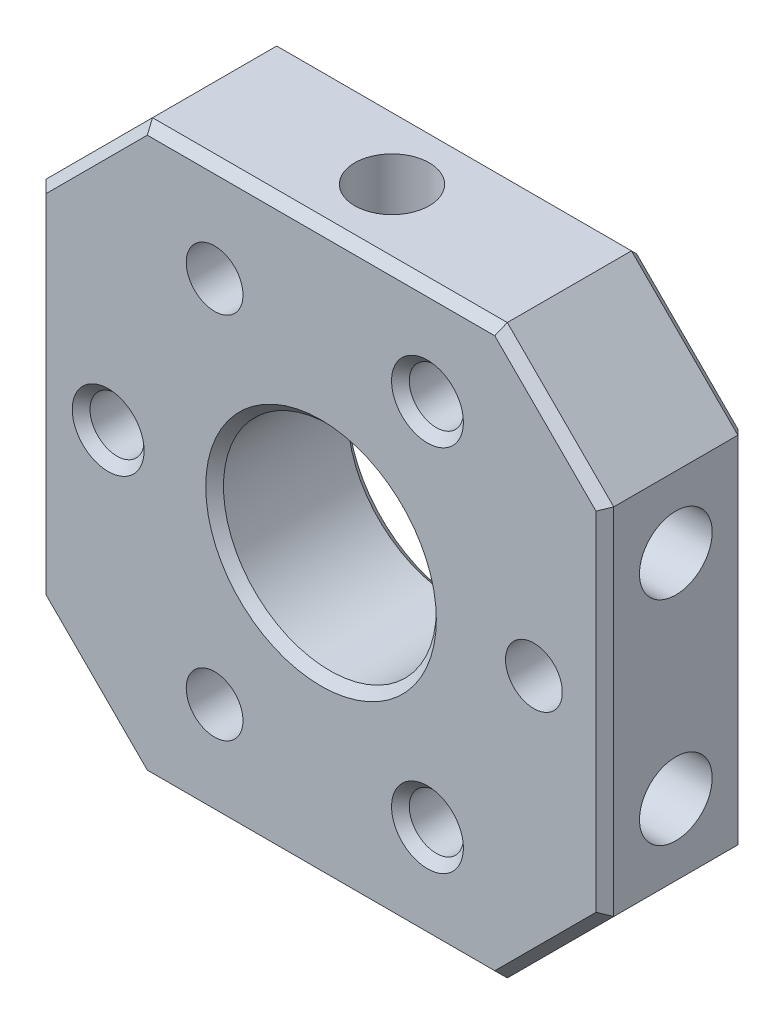
from build123d import *

# Parameters (mm, degrees)
SKETCH_1_W                   = 32
SKETCH_1_H                   = 32
SKETCH_1_R                   = 6
EXTRUDE_1_DEPTH              = 8
SKETCH_2_R                   = 1.525
CUT_EXTRUDE_1_DEPTH          = 4
CHAMFER_1_SIZE               = 6
SKETCH_4_R                   = 2.1
CUT_EXTRUDE_2_DEPTH          = 4.5
SKETCH_5_R                   = 2.05
CUT_EXTRUDE_3_DEPTH          = 4.5
SKETCH_6_R                   = 2.05
CUT_EXTRUDE_4_DEPTH          = 4.5
CUT_EXTRUDE_START            = -4.5
SKETCH_7_R                   = 2.05
CUT_EXTRUDE_5_DEPTH          = 4.5
CHAMFER_2_SIZE               = 0.5
HOLE_WIZARD_M3_1_D           = 3.2
HOLE_WIZARD_M3_1_CBORE_D     = 6
HOLE_WIZARD_M3_1_CBORE_DEPTH = 3.4


with BuildPart() as part:
    # 草图1 → 凸台-拉伸1 (new body)
    with BuildSketch(Plane.XY):
        Rectangle(SKETCH_1_W, SKETCH_1_H)
        Circle(SKETCH_1_R, mode=Mode.SUBTRACT)
    extrude(amount=EXTRUDE_1_DEPTH)

    # 草图2 → 切除-拉伸1 (cut)
    with BuildSketch(Plane.XY.offset(8)):
        with Locations((-12, 0)):
            Circle(SKETCH_2_R)
        with Locations((6, 10.392304845)):
            Circle(SKETCH_2_R)
        with Locations((6, -10.392304845)):
            Circle(SKETCH_2_R)
    extrude(amount=-CUT_EXTRUDE_1_DEPTH, mode=Mode.SUBTRACT)

    # 倒角1
    chamfer_1_edges = [part.edges().sort_by_distance(p)[0] for p in [
        (16, -16, 4),
        (-16, -16, 4),
        (-16, 16, 4),
        (16, 16, 4),
    ]]
    chamfer(chamfer_1_edges, length=CHAMFER_1_SIZE)

    # 草图4 → 切除-拉伸2 (cut)
    with BuildSketch(Plane(origin=(0, 16, 0), x_dir=(1, 0, 0), z_dir=(0, 1, 0))):
        with Locations(Location((0, -4, 0), (0, 0, 270))):
            Circle(SKETCH_4_R)
    extrude(amount=-CUT_EXTRUDE_2_DEPTH, mode=Mode.SUBTRACT)

    # 草图5 → 切除-拉伸3 (cut)
    with BuildSketch(Plane.XZ.offset(16)):
        with Locations(Location((0, 4, 0), (0, 0, 270))):
            Circle(SKETCH_5_R)
    extrude(amount=-CUT_EXTRUDE_3_DEPTH, mode=Mode.SUBTRACT)

    # 草图6 → 切除-拉伸4 (cut)
    with BuildSketch(Plane(origin=(16, 0, 0), x_dir=(0, 0, -1), z_dir=(1, 0, 0))):
        with Locations((-4, 6)):
            Circle(SKETCH_6_R)
        with Locations((-4, -6)):
            Circle(SKETCH_6_R)
    extrude(amount=-CUT_EXTRUDE_4_DEPTH, mode=Mode.SUBTRACT)

    # 草图7 → 切除-拉伸5 (cut)
    with BuildSketch(Plane.ZY.offset(16).offset(CUT_EXTRUDE_START)):
        with Locations(Location((4, 6, 0), (0, 0, 180))):
            Circle(SKETCH_7_R)
        with Locations(Location((4, -6, 0), (0, 0, 180))):
            Circle(SKETCH_7_R)
    extrude(amount=CUT_EXTRUDE_5_DEPTH, mode=Mode.SUBTRACT)

    # 倒角2
    chamfer_2_edges = [part.edges().sort_by_distance(p)[0] for p in [
        (-6, 0, 0),
        (-6, 0, 8),
        (-13.525, 0, 8),
        (4.475, 10.392304845, 8),
        (4.475, -10.392304845, 8),
        (0, -16, 0),
        (0, -16, 8),
        (16, 0, 0),
        (-16, 0, 0),
        (0, 16, 0),
        (13, 13, 0),
        (-13, 13, 0),
        (13, -13, 0),
        (-13, -13, 0),
        (-16, 0, 8),
        (16, 0, 8),
        (0, 16, 8),
        (13, 13, 8),
        (-13, 13, 8),
        (13, -13, 8),
        (-13, -13, 8),
    ]]
    chamfer(chamfer_2_edges, length=CHAMFER_2_SIZE)

    # M3 六角圆柱头螺钉的柱形沉头孔1 (through all)
    with Locations(Plane(origin=(0, 0, 0), x_dir=(-1, 0, 0), z_dir=(0, 0, -1))):
        with Locations((-12, 0), (6, 10.392304845), (6, -10.392304845)):
            CounterBoreHole(HOLE_WIZARD_M3_1_D / 2, HOLE_WIZARD_M3_1_CBORE_D / 2, HOLE_WIZARD_M3_1_CBORE_DEPTH)


solid = part.part
